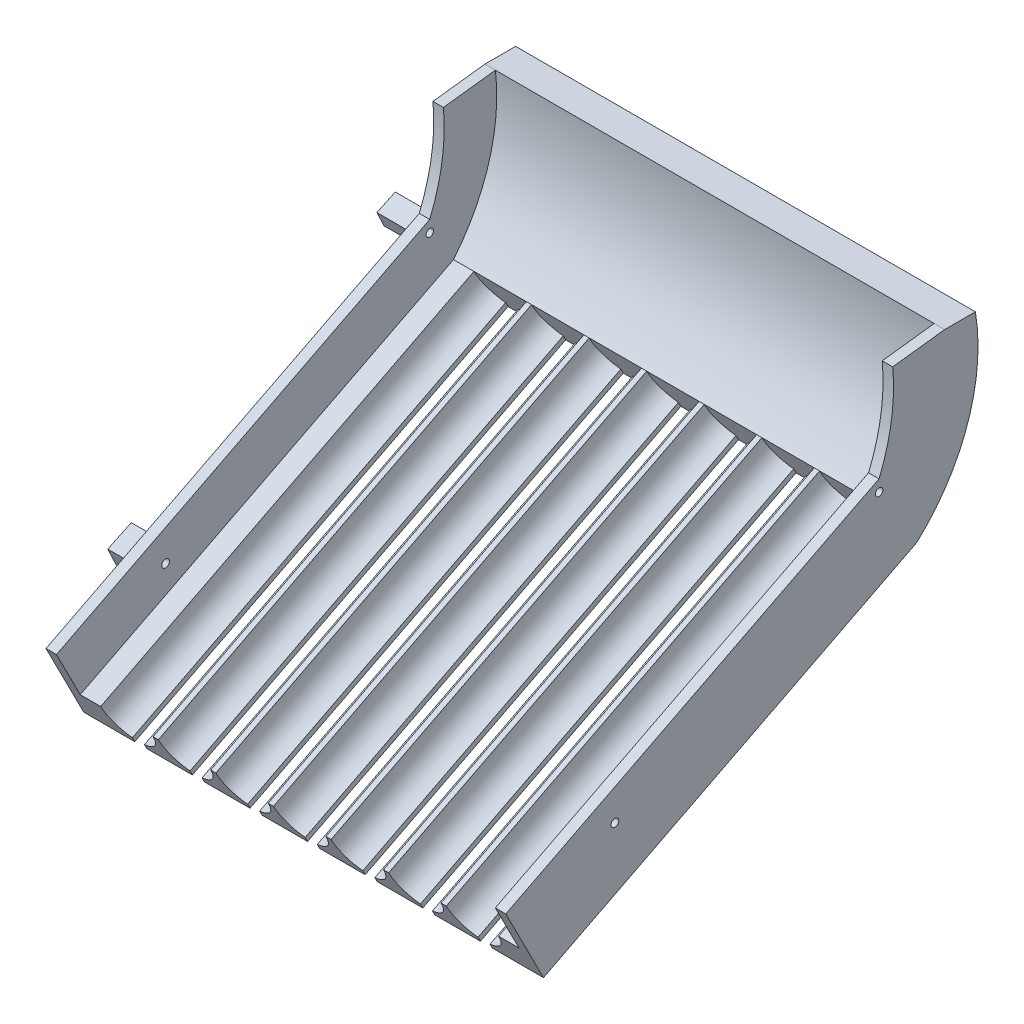
from build123d import *

# Parameters (mm, degrees)
BOSS_EXTRUDE1_DEPTH      = 1234.900343145
BOSS_EXTRUDE1_DEPTH_BACK = 82.174065831
CUT_EXTRUDE1_DEPTH       = 1200
BOSS_EXTRUDE2_DEPTH      = 30
BOSS_EXTRUDE3_DEPTH      = 30
BOSS_EXTRUDE4_START      = -30
BOSS_EXTRUDE4_DEPTH      = 30
BOSS_EXTRUDE5_DEPTH      = 30
BOSS_EXTRUDE6_DEPTH      = 90
CUT_EXTRUDE2_DEPTH       = 1710
CUT_EXTRUDE2_DEPTH_BACK  = 1710
SKETCH12_R               = 11.090448241
SKETCH12_R_2             = 10.749574141


with BuildPart() as part:
    # Sketch1 → Boss-Extrude1 (new, two sides: drawn at the far end of the back side and taken through both)
    with BuildSketch(Plane(origin=(0, 0, 0), x_dir=(0, 0, -1), z_dir=(1, 0, 0)).offset(-BOSS_EXTRUDE1_DEPTH_BACK)):
        with BuildLine():
            Line((-39.951163977, 78.408574129), (0, 0))
            Line((0, 0), (1069.207829026, 544.788599687))
            ThreePointArc((1069.207829026, 544.788599687), (1215.235027559, 767.659323729), (1237.256665049, 1033.197173816))
            Line((1237.256665049, 1033.197173816), (1149.256665049, 1033.197173816))
            ThreePointArc((1149.256665049, 1033.197173816), (1131.408548141, 815.860037301), (1029.256665049, 623.197173816))
            Line((1029.256665049, 623.197173816), (-39.951163977, 78.408574129))
        make_face()
    extrude(amount=BOSS_EXTRUDE1_DEPTH + BOSS_EXTRUDE1_DEPTH_BACK)

    # Sketch2 → Cut-Extrude1 (cut)
    with BuildSketch(Plane(origin=(0, 0, 0), x_dir=(1, 0, 0), z_dir=(0, -0.45399049973954786, 0.8910065241883673))):
        with BuildLine():
            Line((651.363138657, 88), (501.363138657, 88))
            ThreePointArc((501.363138657, 88), (517.561145536, 41.445455593), (559.158488123, 15))
            Line((559.158488123, 15), (559.158488123, 0))
            Line((559.158488123, 0), (593.567789191, 0))
            Line((593.567789191, 0), (593.567789191, 15))
            ThreePointArc((593.567789191, 15), (635.165131778, 41.445455593), (651.363138657, 88))
        make_face()
        with BuildLine():
            ThreePointArc((428.567789191, 15), (470.165131778, 41.445455593), (486.363138657, 88))
            Line((486.363138657, 88), (336.363138657, 88))
            ThreePointArc((336.363138657, 88), (352.561145536, 41.445455593), (394.158488123, 15))
            Line((394.158488123, 15), (394.158488123, 0))
            Line((394.158488123, 0), (428.567789191, 0))
            Line((428.567789191, 0), (428.567789191, 15))
        make_face()
        with BuildLine():
            Line((816.363138657, 88), (666.363138657, 88))
            ThreePointArc((666.363138657, 88), (682.561145536, 41.445455593), (724.158488123, 15))
            Line((724.158488123, 15), (724.158488123, 0))
            Line((724.158488123, 0), (758.567789191, 0))
            Line((758.567789191, 0), (758.567789191, 15))
            ThreePointArc((758.567789191, 15), (800.165131778, 41.445455593), (816.363138657, 88))
        make_face()
        with BuildLine():
            ThreePointArc((263.567789191, 15), (305.165131778, 41.445455593), (321.363138657, 88))
            Line((321.363138657, 88), (171.363138657, 88))
            ThreePointArc((171.363138657, 88), (187.561145536, 41.445455593), (229.158488123, 15))
            Line((229.158488123, 15), (229.158488123, 0))
            Line((229.158488123, 0), (263.567789191, 0))
            Line((263.567789191, 0), (263.567789191, 15))
        make_face()
        with BuildLine():
            Line((981.363138657, 88), (831.363138657, 88))
            ThreePointArc((831.363138657, 88), (847.561145536, 41.445455593), (889.158488123, 15))
            Line((889.158488123, 15), (889.158488123, 0))
            Line((889.158488123, 0), (923.567789191, 0))
            Line((923.567789191, 0), (923.567789191, 15))
            ThreePointArc((923.567789191, 15), (965.165131778, 41.445455593), (981.363138657, 88))
        make_face()
        with BuildLine():
            ThreePointArc((98.567789191, 15), (140.165131778, 41.445455593), (156.363138657, 88))
            Line((156.363138657, 88), (6.363138657, 88))
            ThreePointArc((6.363138657, 88), (22.561145536, 41.445455593), (64.158488123, 15))
            Line((64.158488123, 15), (64.158488123, 0))
            Line((64.158488123, 0), (98.567789191, 0))
            Line((98.567789191, 0), (98.567789191, 15))
        make_face()
        with BuildLine():
            Line((1146.363138657, 88), (996.363138657, 88))
            ThreePointArc((996.363138657, 88), (1012.561145536, 41.445455593), (1054.158488123, 15))
            Line((1054.158488123, 15), (1054.158488123, 0))
            Line((1054.158488123, 0), (1088.567789191, 0))
            Line((1088.567789191, 0), (1088.567789191, 15))
            ThreePointArc((1088.567789191, 15), (1130.165131778, 41.445455593), (1146.363138657, 88))
        make_face()
    extrude(amount=-CUT_EXTRUDE1_DEPTH, mode=Mode.SUBTRACT)

    # Sketch3 → Boss-Extrude2 (add)
    with BuildSketch(Plane(origin=(1234.900343145, 0, 0), x_dir=(0, 0, -1), z_dir=(1, 0, 0))):
        Polygon((-39.951163977, 78.408574129), (-108.049738938, 212.059552757), (961.158090088, 756.848152444), (1029.256665049, 623.197173816), align=None)
    extrude(amount=-BOSS_EXTRUDE2_DEPTH)

    # Sketch6 → Boss-Extrude3 (add)
    with BuildSketch(Plane.ZY.offset(82.174065831)):
        Polygon((-1029.256665049, 623.197173816), (-961.158090088, 756.848152444), (108.049738938, 212.059552757), (39.951163977, 78.408574129), align=None)
    extrude(amount=-BOSS_EXTRUDE3_DEPTH)

    # Sketch9 → Boss-Extrude4 (add)
    with BuildSketch(Plane(origin=(1234.900343145, 0, 0), x_dir=(0, 0, -1), z_dir=(1, 0, 0)).offset(BOSS_EXTRUDE4_START)):
        with BuildLine():
            Line((1149.256665049, 1033.197173816), (1000.350769421, 1015.113085582))
            ThreePointArc((1000.350769421, 1015.113085582), (996.565266489, 883.581264805), (961.158090088, 756.848152444))
            Line((961.158090088, 756.848152444), (1029.256665049, 623.197173816))
            ThreePointArc((1029.256665049, 623.197173816), (1131.408548141, 815.860037301), (1149.256665049, 1033.197173816))
        make_face()
    extrude(amount=BOSS_EXTRUDE4_DEPTH)

    # Sketch10 → Boss-Extrude5 (add)
    with BuildSketch(Plane.ZY.offset(82.174065831)):
        with BuildLine():
            Line((-1029.256665049, 623.197173816), (-961.158090088, 756.848152444))
            ThreePointArc((-961.158090088, 756.848152444), (-996.565266489, 883.581264805), (-1000.350769421, 1015.113085582))
            Line((-1000.350769421, 1015.113085582), (-1149.256665049, 1033.197173816))
            ThreePointArc((-1149.256665049, 1033.197173816), (-1131.408548141, 815.860037301), (-1029.256665049, 623.197173816))
        make_face()
    extrude(amount=-BOSS_EXTRUDE5_DEPTH)

    # Sketch11 → Boss-Extrude6 (add)
    with BuildSketch(Plane.ZY.offset(82.174065831)):
        Polygon((-982.226090398, 754.490949456), (-929.767856808, 729.642312493), (-950.23144019, 686.441414242), (-1002.68967378, 711.290051206), align=None)
        Polygon((-226.133327046, 312.103551466), (-158.807904246, 280.212561719), (-183.700784796, 227.660925002), (-251.919927814, 257.665172066), align=None)
    extrude(amount=BOSS_EXTRUDE6_DEPTH)

    # Sketch12 → Cut-Extrude2 (cut, two sides: drawn at the far end of the back side and taken through both)
    with BuildSketch(Plane(origin=(1234.900343145, 0, 0), x_dir=(0, 0, -1), z_dir=(1, 0, 0)).offset(-CUT_EXTRUDE2_DEPTH_BACK)):
        with Locations((204.62902054, 281.838763818)):
            Circle(SKETCH12_R)
        with Locations((961.389588636, 723.712275526)):
            Circle(SKETCH12_R_2)
    extrude(amount=CUT_EXTRUDE2_DEPTH + CUT_EXTRUDE2_DEPTH_BACK, mode=Mode.SUBTRACT)


solid = part.part
